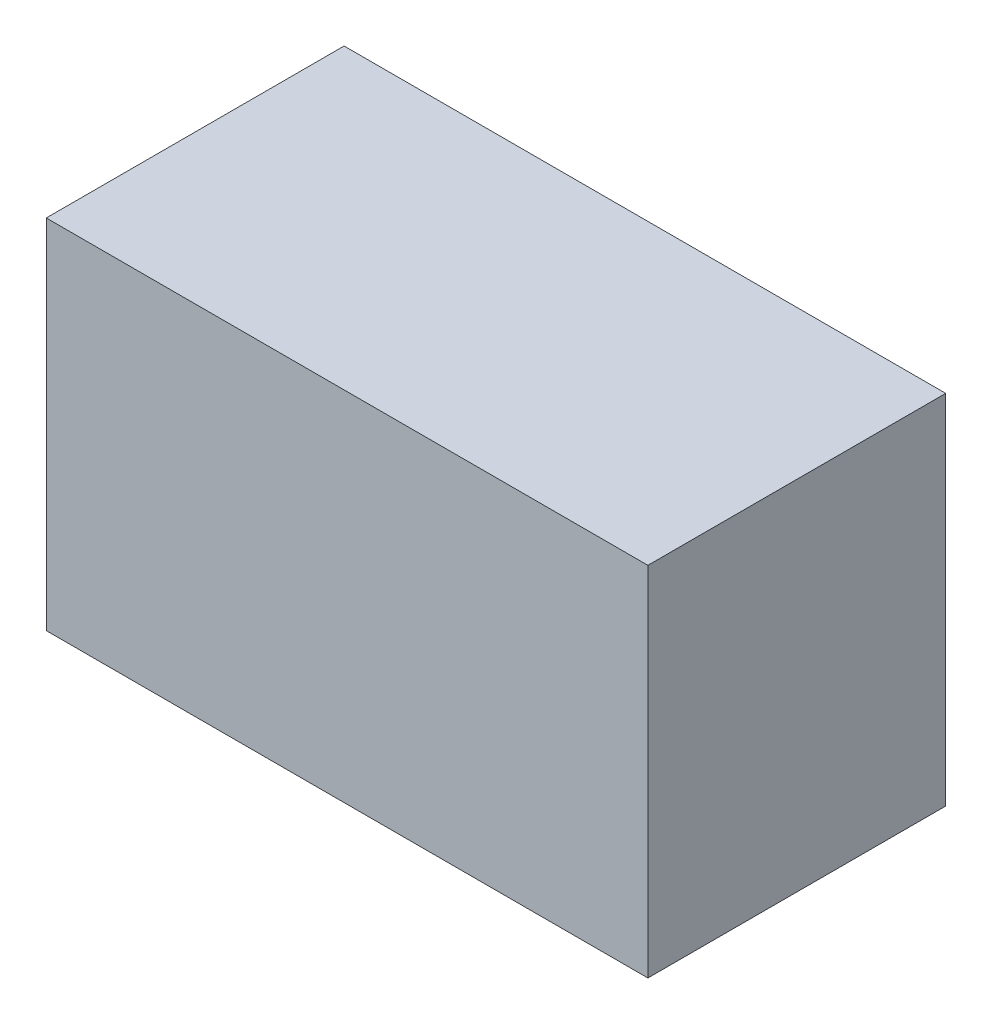
from build123d import *

# Parameters (mm, degrees)
CROQUIS1_W              = 20.2
CROQUIS1_H              = 10
SALIENTE_EXTRUIR1_DEPTH = 12


with BuildPart() as part:
    # Croquis1 → Saliente-Extruir1 (new body)
    with BuildSketch(Plane(origin=(0, 0, 0), x_dir=(1, 0, 0), z_dir=(0, 1, 0))):
        Rectangle(CROQUIS1_W, CROQUIS1_H)
    extrude(amount=SALIENTE_EXTRUIR1_DEPTH)


solid = part.part
